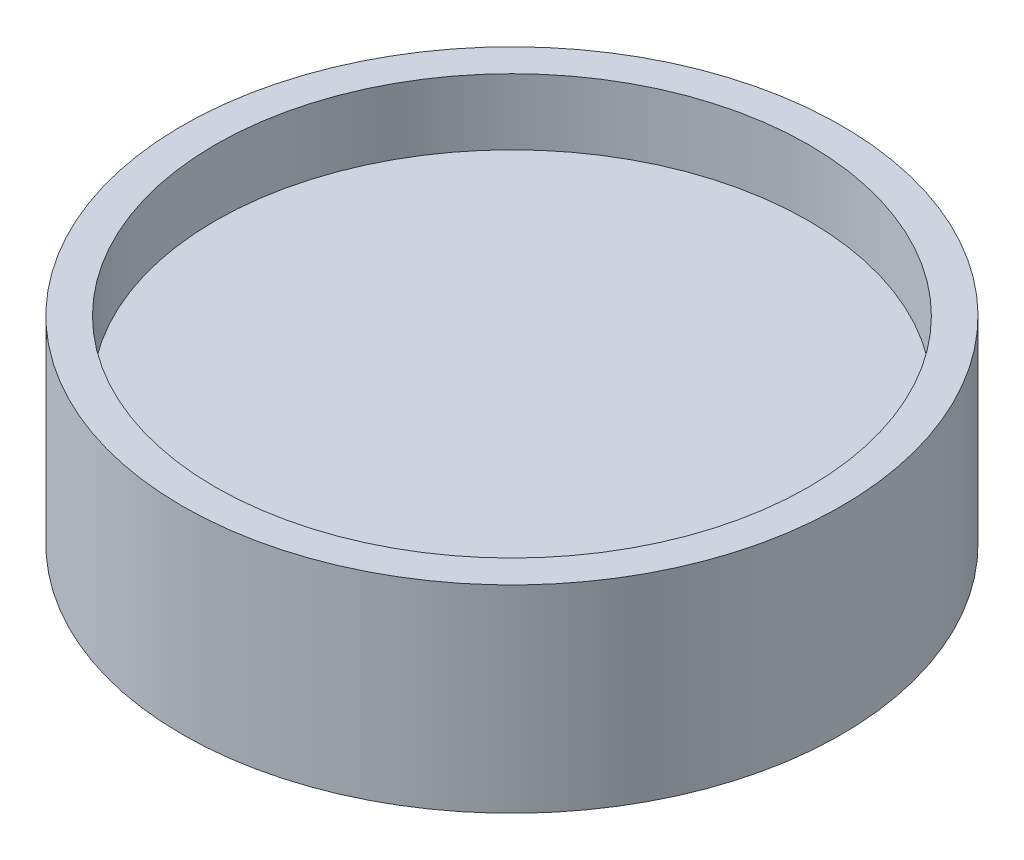
from build123d import *

# Parameters (mm, degrees)
SKETCH3_R           = 50
BOSS_EXTRUDE1_DEPTH = 30
SKETCH4_R           = 45
CUT_EXTRUDE1_DEPTH  = 10
CUT_EXTRUDE2_START  = -19
SKETCH5_R           = 45
CUT_EXTRUDE2_DEPTH  = 19


with BuildPart() as part:
    # Sketch3 → Boss-Extrude1 (new body)
    with BuildSketch(Plane(origin=(0, 0, 0), x_dir=(1, 0, 0), z_dir=(0, 1, 0))):
        with Locations(Location((0, 0, 0), (0, 0, 270))):
            Circle(SKETCH3_R)
    extrude(amount=BOSS_EXTRUDE1_DEPTH)

    # Sketch4 → Cut-Extrude1 (cut)
    with BuildSketch(Plane(origin=(0, 30, 0), x_dir=(1, 0, 0), z_dir=(0, 1, 0))):
        with Locations(Location((0, 0, 0), (0, 0, 270))):
            Circle(SKETCH4_R)
    extrude(amount=-CUT_EXTRUDE1_DEPTH, mode=Mode.SUBTRACT)

    # Sketch5 → Cut-Extrude2 (cut)
    with BuildSketch(Plane.XZ.offset(CUT_EXTRUDE2_START)):
        with Locations(Location((0, 0, 0), (0, 0, 90))):
            Circle(SKETCH5_R)
    extrude(amount=CUT_EXTRUDE2_DEPTH, mode=Mode.SUBTRACT)


solid = part.part
